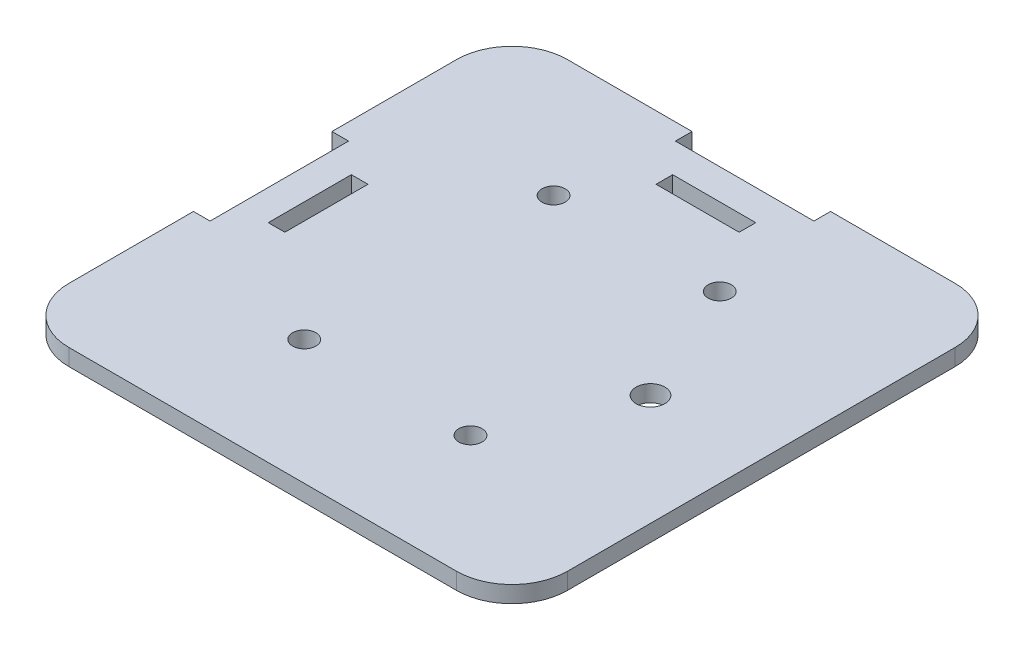
from build123d import *

# Parameters (mm, degrees)
BOSS_EXTRUDE1_DEPTH = 3
SKETCH2_R           = 2.1
CUT_EXTRUDE1_DEPTH  = 3
SKETCH3_W           = 15
SKETCH3_H           = 3
SKETCH3_W_2         = 3
SKETCH3_H_2         = 15
CUT_EXTRUDE2_DEPTH  = 10
SKETCH4_R           = 2.6
CUT_EXTRUDE3_DEPTH  = 14


with BuildPart() as part:
    # Sketch1 → Boss-Extrude1 (new body)
    with BuildSketch(Plane(origin=(0, 0, 0), x_dir=(1, 0, 0), z_dir=(0, 1, 0))):
        with BuildLine():
            Line((-35, -45), (35, -45))
            ThreePointArc((35, -45), (42.071067812, -42.071067812), (45, -35))
            Line((45, -35), (45, 35))
            ThreePointArc((45, 35), (42.071067812, 42.071067812), (35, 45))
            Line((35, 45), (12.5, 45))
            Line((12.5, 45), (12.5, 42))
            Line((12.5, 42), (-12.5, 42))
            Line((-12.5, 42), (-12.5, 45))
            Line((-12.5, 45), (-35, 45))
            ThreePointArc((-35, 45), (-42.071067812, 42.071067812), (-45, 35))
            Line((-45, 35), (-45, 12.5))
            Line((-45, 12.5), (-42, 12.5))
            Line((-42, 12.5), (-42, -12.5))
            Line((-42, -12.5), (-45, -12.5))
            Line((-45, -12.5), (-45, -35))
            ThreePointArc((-45, -35), (-42.071067812, -42.071067812), (-35, -45))
        make_face()
    extrude(amount=BOSS_EXTRUDE1_DEPTH)

    # Sketch2 → Cut-Extrude1 (cut)
    with BuildSketch(Plane(origin=(0, 3, 0), x_dir=(1, 0, 0), z_dir=(0, 1, 0))):
        with Locations(Location((-15, 22.5, 0), (0, 0, 270))):
            Circle(SKETCH2_R)
        with Locations(Location((15, 22.5, 0), (0, 0, 90))):
            Circle(SKETCH2_R)
        with Locations(Location((15, -22.5, 0), (0, 0, 270))):
            Circle(SKETCH2_R)
        with Locations(Location((-15, -22.5, 0), (0, 0, 90))):
            Circle(SKETCH2_R)
    extrude(amount=-CUT_EXTRUDE1_DEPTH, mode=Mode.SUBTRACT)

    # Sketch3 → Cut-Extrude2 (cut)
    with BuildSketch(Plane(origin=(0, 3, 0), x_dir=(1, 0, 0), z_dir=(0, 1, 0))):
        with Locations((0, 35)):
            Rectangle(SKETCH3_W, SKETCH3_H)
        with Locations((-35, 0)):
            Rectangle(SKETCH3_W_2, SKETCH3_H_2)
    extrude(amount=-CUT_EXTRUDE2_DEPTH, mode=Mode.SUBTRACT)

    # Sketch4 → Cut-Extrude3 (cut)
    with BuildSketch(Plane(origin=(0, 3, 0), x_dir=(1, 0, 0), z_dir=(0, 1, 0))):
        with Locations(Location((25, 0, 0), (0, 0, 270))):
            Circle(SKETCH4_R)
    extrude(amount=-CUT_EXTRUDE3_DEPTH, mode=Mode.SUBTRACT)


solid = part.part
